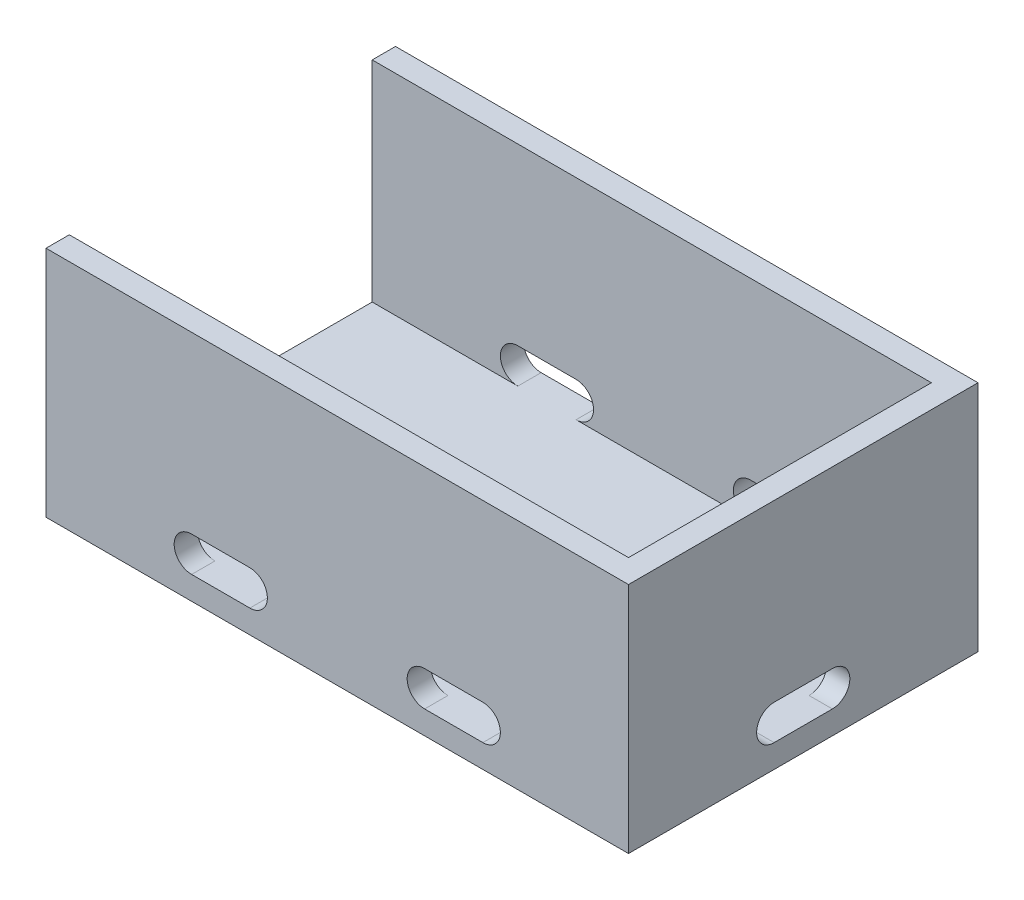
from build123d import *

# Parameters (mm, degrees)
EXTRUDE_THIN1_DEPTH     = 18
SKETCH2_W               = 50
SKETCH2_H               = 30
BOSS_EXTRUDE1_DEPTH     = 2
CUT_EXTRUDE1_DEPTH      = 62.02458521
CUT_EXTRUDE1_DEPTH_BACK = 62.02458521
CUT_EXTRUDE2_DEPTH      = 60.39696962
CUT_EXTRUDE2_DEPTH_BACK = 60.39696962


with BuildPart() as part:
    # Sketch1 → Extrude-Thin1 (new body)
    with BuildSketch(Plane(origin=(0, 0, 0), x_dir=(1, 0, 0), z_dir=(0, 1, 0))):
        Polygon((0, 28), (48, 28), (48, 2), (0, 2), (0, 0), (50, 0), (50, 30), (0, 30), align=None)
    extrude(amount=EXTRUDE_THIN1_DEPTH)

    # Sketch2 → Boss-Extrude1 (add)
    with BuildSketch(Plane.XZ):
        with Locations((25, -15)):
            Rectangle(SKETCH2_W, SKETCH2_H)
    extrude(amount=BOSS_EXTRUDE1_DEPTH)

    # Sketch3 → Cut-Extrude1 (cut, two sides: drawn at the far end of the back side and taken through both)
    with BuildSketch(Plane.XY.offset(-CUT_EXTRUDE1_DEPTH_BACK)):
        with BuildLine():
            Line((12.5, 3), (17.5, 3))
            ThreePointArc((17.5, 3), (19, 1.5), (17.5, 0))
            Line((17.5, 0), (12.5, 0))
            ThreePointArc((12.5, 0), (11, 1.5), (12.5, 3))
        make_face()
        with BuildLine():
            Line((37.5, 3), (32.5, 3))
            ThreePointArc((32.5, 3), (31, 1.5), (32.5, 0))
            Line((32.5, 0), (37.5, 0))
            ThreePointArc((37.5, 0), (39, 1.5), (37.5, 3))
        make_face()
    extrude(amount=CUT_EXTRUDE1_DEPTH + CUT_EXTRUDE1_DEPTH_BACK, mode=Mode.SUBTRACT)

    # Sketch4 → Cut-Extrude2 (cut, two sides: drawn at the far end of the back side and taken through both)
    with BuildSketch(Plane.ZY.offset(-48).offset(-CUT_EXTRUDE2_DEPTH_BACK)):
        with BuildLine():
            Line((-17.5, 3), (-12.5, 3))
            ThreePointArc((-12.5, 3), (-11, 1.5), (-12.5, 0))
            Line((-12.5, 0), (-17.5, 0))
            ThreePointArc((-17.5, 0), (-19, 1.5), (-17.5, 3))
        make_face()
    extrude(amount=CUT_EXTRUDE2_DEPTH + CUT_EXTRUDE2_DEPTH_BACK, mode=Mode.SUBTRACT)


solid = part.part
